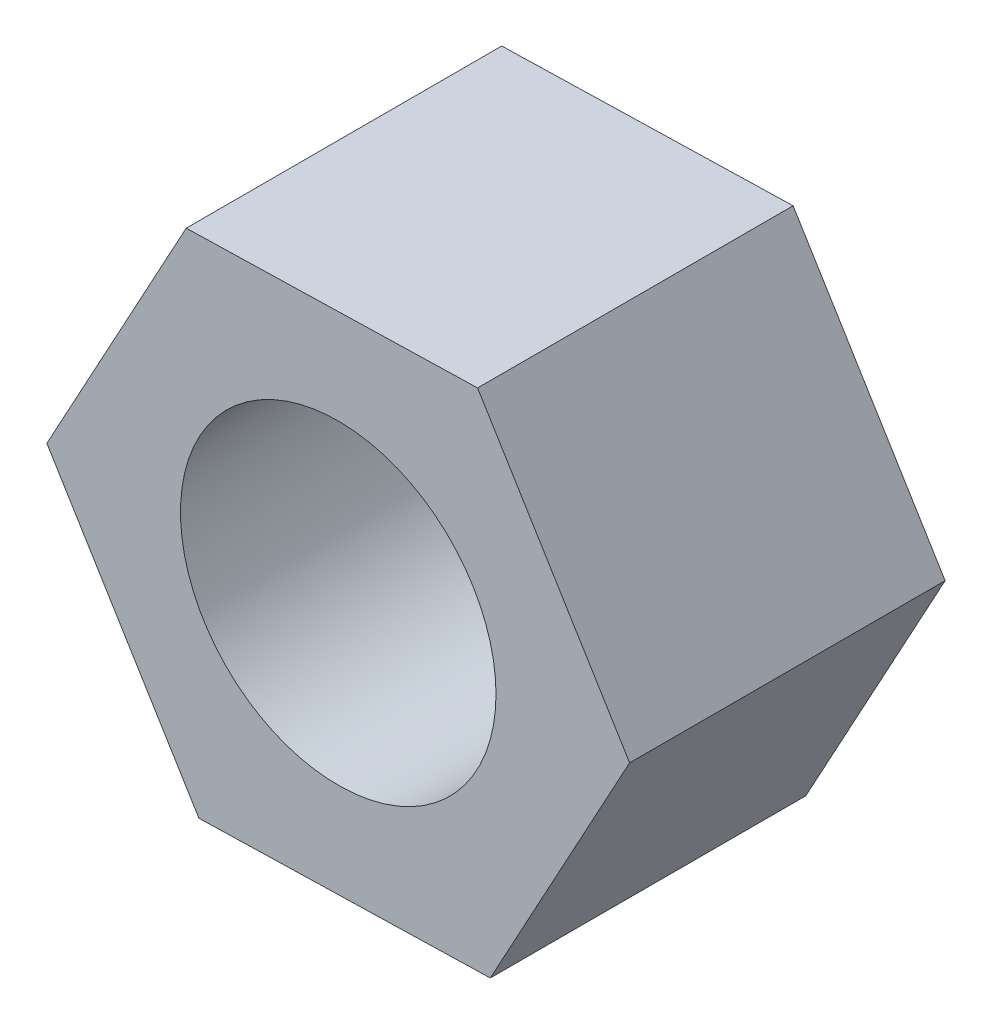
from build123d import *

# Parameters (mm, degrees)
BOSS_EXTRUDE2_DEPTH = 5
SKETCH3_R           = 2.5
CUT_EXTRUDE1_DEPTH  = 9


with BuildPart() as part:
    # Sketch1 → Boss-Extrude2 (new body)
    with BuildSketch(Plane(origin=(0, 0, 0), x_dir=(0, 1, 0), z_dir=(0, 0, 1))):
        Polygon((4.056748621, -2.208194728), (3.940727042, 2.409149999), (-0.116021579, 4.617344727), (-4.056748621, 2.208194728), (-3.940727042, -2.409149999), (0.116021579, -4.617344727), align=None)
    extrude(amount=BOSS_EXTRUDE2_DEPTH)

    # Sketch3 → Cut-Extrude1 (cut, symmetric)
    with BuildSketch(Plane.XY.offset(5)):
        Circle(SKETCH3_R)
    extrude(amount=CUT_EXTRUDE1_DEPTH, both=True, mode=Mode.SUBTRACT)


solid = part.part
